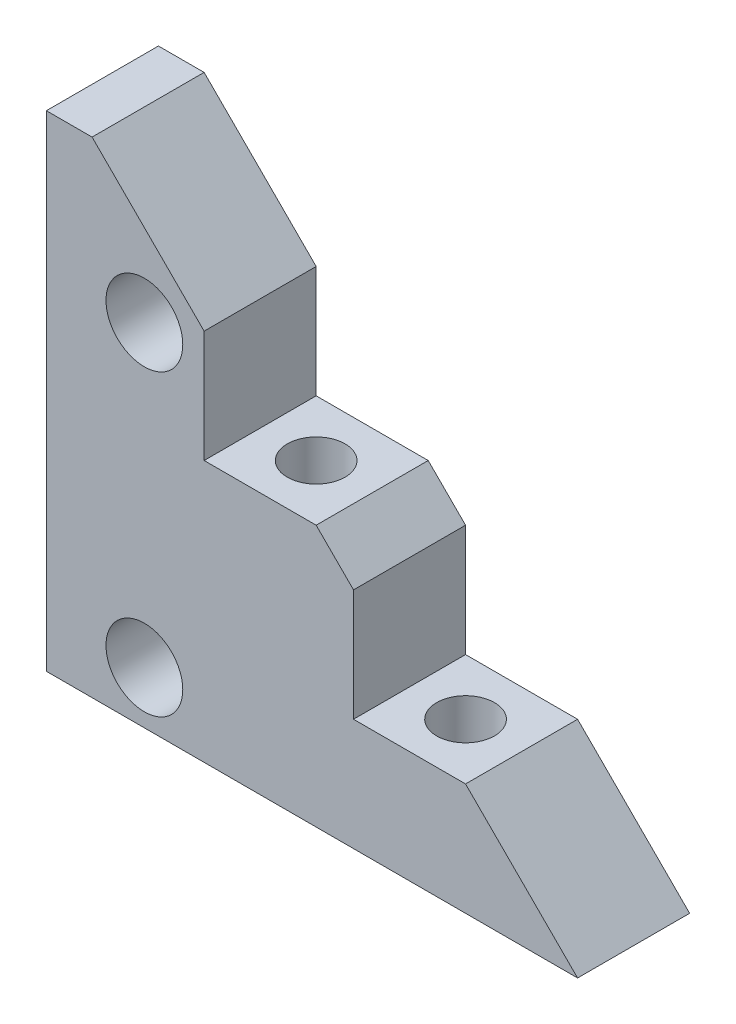
from build123d import *

# Parameters (mm, degrees)
BOSS_EXTRUDE1_DEPTH          = 9.525
SKETCH3_R                    = 3.2639
CUT_EXTRUDE1_DEPTH           = 60.143696832
SKETCH4_W                    = 3.8862
SKETCH4_H                    = 41.275
BOSS_EXTRUDE2_DEPTH          = 9.525
F_10_0_1935_DIAMETER_HOLE1_D = 4.9149


with BuildPart() as part:
    # Sketch2 → Boss-Extrude1 (new body)
    with BuildSketch(Plane.XY):
        Polygon((0, 0), (41.275, 0), (31.75, 9.525), (22.225, 9.525), (22.225, 19.05), (19.05, 22.225), (9.525, 22.225), (9.525, 31.75), (0, 41.275), align=None)
    extrude(amount=BOSS_EXTRUDE1_DEPTH)

    # Sketch3 → Cut-Extrude1 (cut, through all)
    with BuildSketch(Plane.XY.offset(9.525)):
        with Locations((4.445, 29.845)):
            Circle(SKETCH3_R)
        with Locations((4.445, 4.445)):
            Circle(SKETCH3_R)
    extrude(amount=-CUT_EXTRUDE1_DEPTH, mode=Mode.SUBTRACT)

    # Sketch4 → Boss-Extrude2 (add)
    with BuildSketch(Plane(origin=(0, 0, 0), x_dir=(-1, 0, 0), z_dir=(0, 0, -1))):
        with Locations((1.9431, 20.6375)):
            Rectangle(SKETCH4_W, SKETCH4_H)
    extrude(amount=-BOSS_EXTRUDE2_DEPTH)

    # #10 (0.1935) Diameter Hole1 (through all)
    with Locations(Plane(origin=(0, 22.225, 0), x_dir=(1, 0, 0), z_dir=(0, 1, 0))):
        with Locations((14.2875, -4.7625), (26.9875, -4.7625)):
            Hole(F_10_0_1935_DIAMETER_HOLE1_D / 2)


solid = part.part
